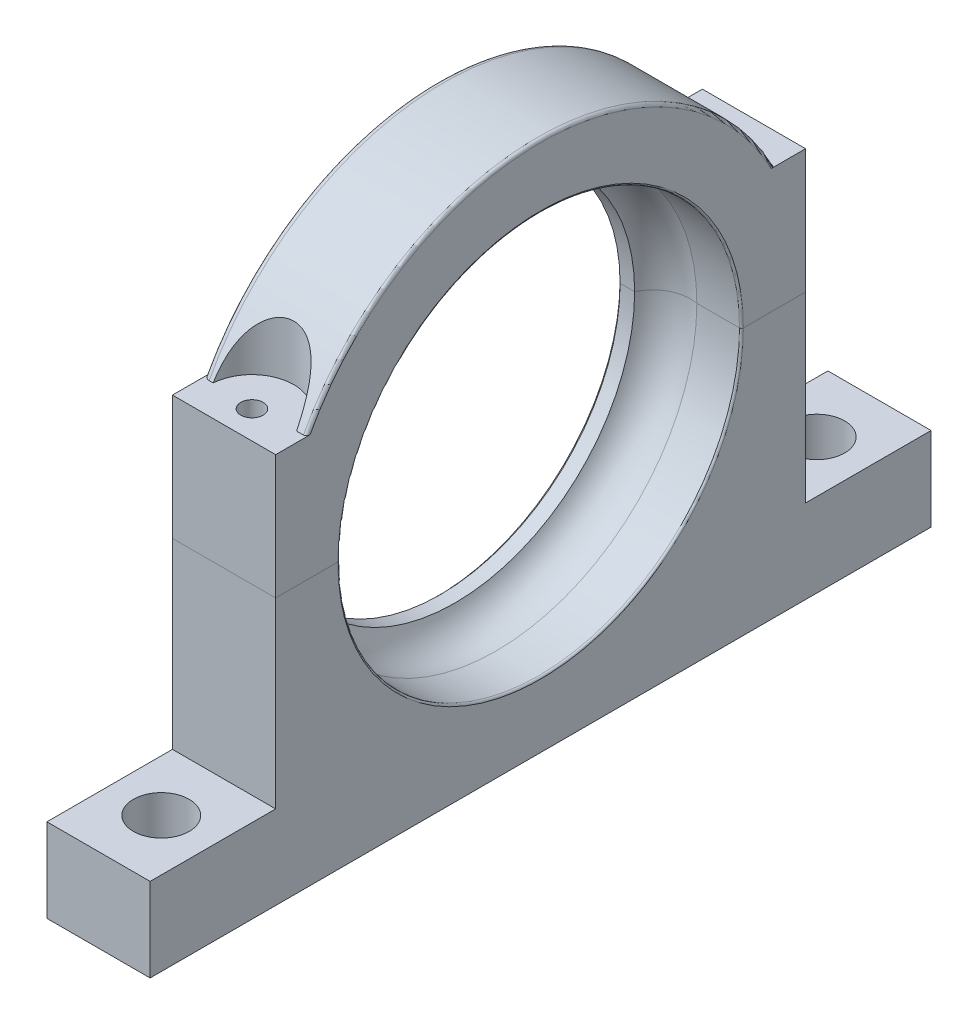
from build123d import *

# Parameters (mm, degrees)
BOSS_EXTRU_2_DEPTH           = 37
ESQUISSE4_R                  = 15
ENL_V_MAT_EXTRU_1_DEPTH      = 37
ESQUISSE6_R                  = 4
ENL_V_MAT_EXTRU_2_DEPTH      = 100
ESQUISSE7_R                  = 10
ENL_V_MAT_EXTRU_3_DEPTH      = 217.169494105
FRACTIONNER2_SURFACE_1_BACK  = 341.675
FRACTIONNER2_SURFACE_1_DEPTH = 683.35
FRACTIONNER2_SURFACE_2_BACK  = 341.675
FRACTIONNER2_SURFACE_2_DEPTH = 683.35


with BuildPart() as part:
    # Esquisse1 → Révolution1 (revolve)
    with BuildSketch(Plane.XY, mode=Mode.PRIVATE) as r_volution1_sk:
        with BuildLine():
            Line((0, 92.899985), (0, 65.5))
            Line((0, 65.5), (1.05, 64.45))
            Line((1.05, 64.45), (6.268972406, 64.45))
            ThreePointArc((6.268972406, 64.45), (12.33952319, 70.755688713), (21.002086329, 72.01))
            Line((21.002086329, 72.01), (36.3, 72.01))
            ThreePointArc((36.3, 72.01), (36.794969719, 72.215020225), (37, 72.709985779))
            Line((37, 72.709985779), (37, 93.899984804))
            ThreePointArc((37, 93.899984804), (36.677822915, 94.67781224), (35.9, 95.000000237))
            Line((35.9, 95.000000237), (2.1, 95.000000237))
            ThreePointArc((2.1, 95.000000237), (0.615070373, 94.38491909), (0, 92.899985))
        make_face()
    revolve(r_volution1_sk.sketch.rotate(Axis((-0.001288092, 0, 0), (1, 0, 0)), 270), axis=Axis((-0.001288092, 0, 0), (1, 0, 0)))

    # Esquisse2 → Boss.-Extru.2 (add)
    with BuildSketch(Plane.ZY):
        with BuildLine():
            Line((-95.000000237, 44.5), (-95.000000237, -65.5))
            Line((-95.000000237, -65.5), (-140.000000237, -65.5))
            Line((-140.000000237, -65.5), (-140.000000237, -95.5))
            Line((-140.000000237, -95.5), (140.000000237, -95.5))
            Line((140.000000237, -95.5), (140.000000237, -65.5))
            Line((140.000000237, -65.5), (95.000000237, -65.5))
            Line((95.000000237, -65.5), (95.000000237, 44.5))
            Line((95.000000237, 44.5), (81.548496081, 44.5))
            ThreePointArc((81.548496081, 44.5), (90.017390752, 22.962503678), (92.899985, 0))
            ThreePointArc((92.899985, 0), (0, -92.899985), (-92.899985, 0))
            ThreePointArc((-92.899985, 0), (-90.017390752, 22.962503678), (-81.548496081, 44.5))
            Line((-81.548496081, 44.5), (-95.000000237, 44.5))
        make_face()
    extrude(amount=-BOSS_EXTRU_2_DEPTH)

    # Esquisse4 → Enlèv. mat.-Extru.1 (cut)
    with BuildSketch(Plane(origin=(0, 44.5, 0), x_dir=(1, 0, 0), z_dir=(0, 1, 0))):
        with Locations((18.5, 85.000000237)):
            Circle(ESQUISSE4_R)
    enl_v_mat_extru_1 = extrude(amount=ENL_V_MAT_EXTRU_1_DEPTH, mode=Mode.SUBTRACT)

    # Esquisse6 → Enlèv. mat.-Extru.2 (cut)
    with BuildSketch(Plane(origin=(0, 44.5, 0), x_dir=(1, 0, 0), z_dir=(0, 1, 0))):
        with Locations(Location((18.5, 85.000000237, 0), (0, 0, 270))):
            Circle(ESQUISSE6_R)
    enl_v_mat_extru_2 = extrude(amount=-ENL_V_MAT_EXTRU_2_DEPTH, mode=Mode.SUBTRACT)

    # Esquisse7 → Enlèv. mat.-Extru.3 (cut, through all)
    with BuildSketch(Plane(origin=(0, -65.5, 0), x_dir=(1, 0, 0), z_dir=(0, 1, 0))):
        with Locations(Location((18.5, 117.500000237, 0), (0, 0, 270))):
            Circle(ESQUISSE7_R)
    enl_v_mat_extru_3 = extrude(amount=-ENL_V_MAT_EXTRU_3_DEPTH, mode=Mode.SUBTRACT)

    # Symétrie1: Enlèv. mat.-Extru.1, Enlèv. mat.-Extru.2, Enlèv. mat.-Extru.3 across plane
    add(enl_v_mat_extru_1.mirror(Plane.XY), mode=Mode.SUBTRACT)
    add(enl_v_mat_extru_2.mirror(Plane.XY), mode=Mode.SUBTRACT)
    add(enl_v_mat_extru_3.mirror(Plane.XY), mode=Mode.SUBTRACT)


with BuildPart() as body_2:
    # Fractionner2: the piece behind the surface
    add(part.part)
    # Fractionner2 surface: a surface, the sketch's curves swept straight by 683.35 mm
    with BuildLine(Plane(origin=(37, 0, 0), x_dir=(0, 0, -1), z_dir=(1, 0, 0)).offset(-FRACTIONNER2_SURFACE_1_BACK), mode=Mode.PRIVATE) as fractionner2_surface_1_path:
        Line((-95.000000237, 0), (95.000000237, 0))
    fractionner2_surface_1 = Shell.extrude(fractionner2_surface_1_path.wire(), (1 * FRACTIONNER2_SURFACE_1_DEPTH, 0 * FRACTIONNER2_SURFACE_1_DEPTH, 0 * FRACTIONNER2_SURFACE_1_DEPTH))
    split(bisect_by=fractionner2_surface_1, keep=Keep.BOTTOM)


with BuildPart() as part_1:
    add(part.part)

    # Fractionner2: split by a surface, the side it looks to stays
    # Fractionner2 surface: a surface, the sketch's curves swept straight by 683.35 mm
    with BuildLine(Plane(origin=(37, 0, 0), x_dir=(0, 0, -1), z_dir=(1, 0, 0)).offset(-FRACTIONNER2_SURFACE_2_BACK), mode=Mode.PRIVATE) as fractionner2_surface_2_path:
        Line((-95.000000237, 0), (95.000000237, 0))
    fractionner2_surface_2 = Shell.extrude(fractionner2_surface_2_path.wire(), (1 * FRACTIONNER2_SURFACE_2_DEPTH, 0 * FRACTIONNER2_SURFACE_2_DEPTH, 0 * FRACTIONNER2_SURFACE_2_DEPTH))
    split(bisect_by=fractionner2_surface_2, keep=Keep.TOP)


solid = Compound([body_2.part, part_1.part])
